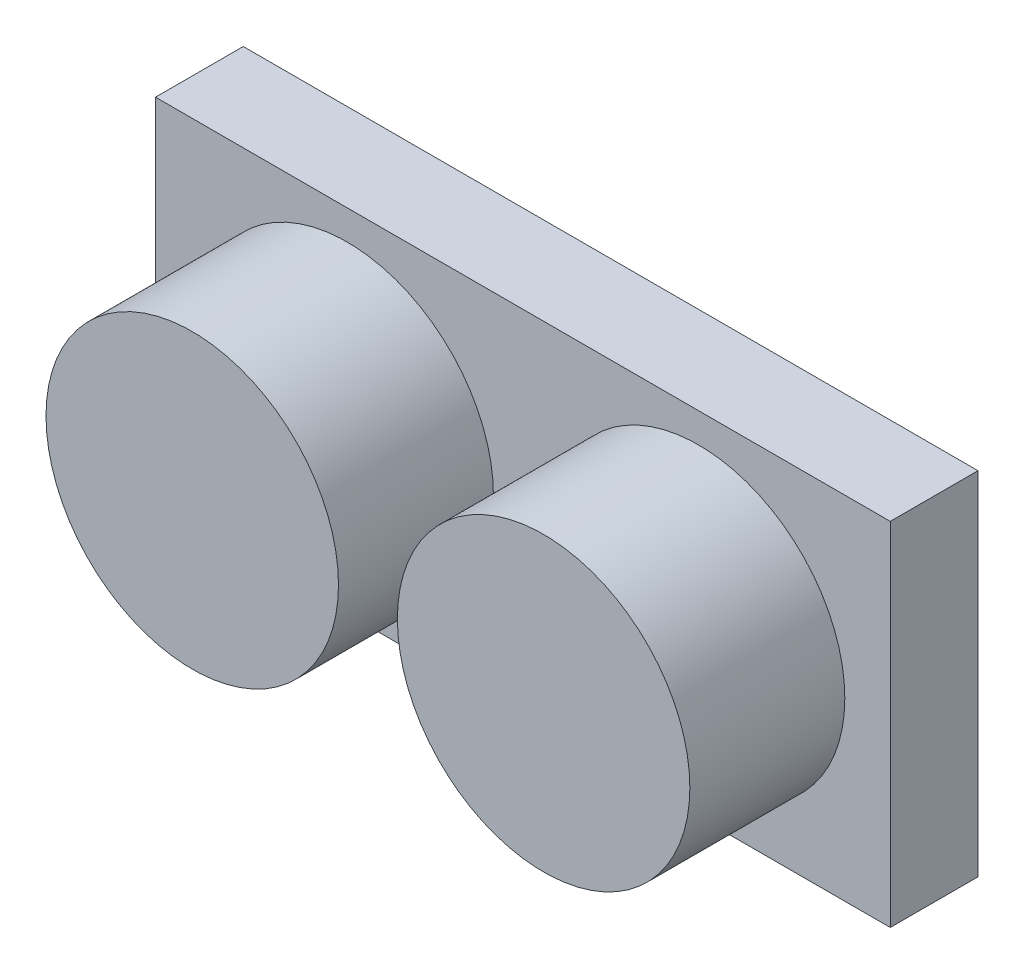
from build123d import *

# Parameters (mm, degrees)
SKETCH_3_W      = 25.120236726
SKETCH_3_H      = 12.02564524
EXTRUDE_1_DEPTH = 3
SKETCH_4_R      = 5
EXTRUDE_2_DEPTH = 5.297900912


with BuildPart() as part:
    # 草图3 → 凸台-拉伸1 (new body)
    with BuildSketch(Plane.XY):
        Rectangle(SKETCH_3_W, SKETCH_3_H)
    extrude(amount=EXTRUDE_1_DEPTH)

    # 草图4 → 凸台-拉伸2 (add)
    with BuildSketch(Plane.XY.offset(3)):
        with Locations((6.006662197, 0)):
            Circle(SKETCH_4_R)
        with Locations(Location((-6.006662197, 0, 0), (0, 0, 180))):
            Circle(SKETCH_4_R)
    extrude(amount=EXTRUDE_2_DEPTH)


solid = part.part
